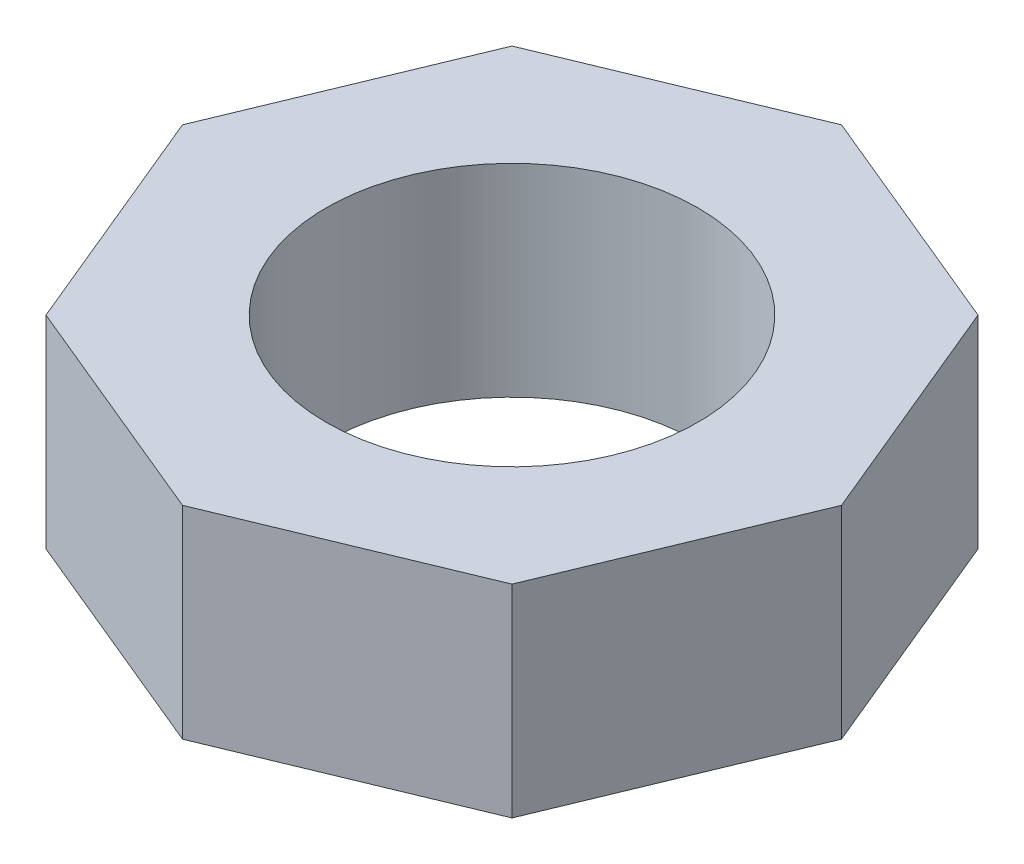
from build123d import *

# Parameters (mm, degrees)
SKETCH1_R           = 1.4225
BOSS_EXTRUDE1_DEPTH = 1.55


with BuildPart() as part:
    # Sketch1 → Boss-Extrude1 (new body)
    with BuildSketch(Plane(origin=(0, 0, 0), x_dir=(1, 0, 0), z_dir=(0, 1, 0))):
        Polygon((2.521973827, 0), (1.783304795, 1.783304795), (0, 2.521973827), (-1.783304795, 1.783304795), (-2.521973827, 0), (-1.783304795, -1.783304795), (0, -2.521973827), (1.783304795, -1.783304795), align=None)
        with Locations(Location((0, 0, 0), (0, 0, 90))):
            Circle(SKETCH1_R, mode=Mode.SUBTRACT)
    extrude(amount=BOSS_EXTRUDE1_DEPTH)


solid = part.part
